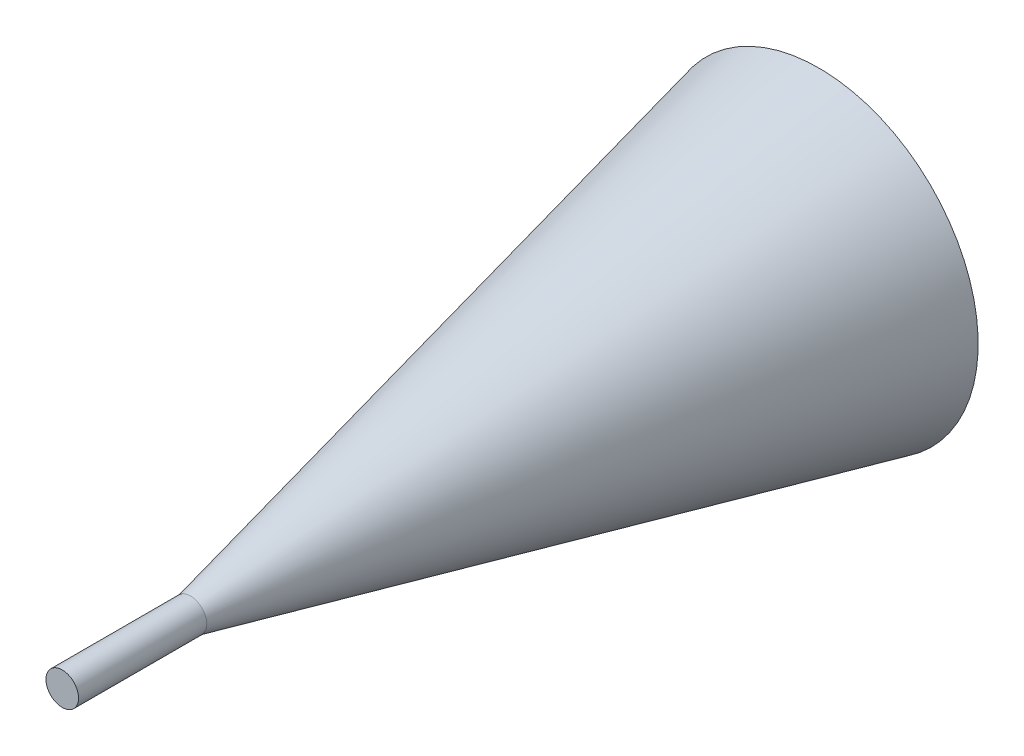
from build123d import *

# Parameters (mm, degrees)
SKETCH1_W           = 71.12
SKETCH1_H           = 71.12
BOSS_EXTRUDE1_DEPTH = 4.7625
SKETCH2_R           = 3.4925
CUT_EXTRUDE1_DEPTH  = 51.514439582
SKETCH3_R           = 12.425
BOSS_EXTRUDE2_DEPTH = 49
SKETCH5_R           = 1.27
BOSS_EXTRUDE3_DEPTH = 10
FILLET1_R           = 2.5
SKETCH6_W           = 86.163151286
SKETCH6_H           = 93.634187614
CUT_EXTRUDE2_DEPTH  = 4.7625
SKETCH7_R           = 2.667
CUT_EXTRUDE3_DEPTH  = 10


with BuildPart() as part:
    # Sketch1 → Boss-Extrude1 (new body)
    with BuildSketch(Plane.XY):
        Rectangle(SKETCH1_W, SKETCH1_H)
    extrude(amount=BOSS_EXTRUDE1_DEPTH)

    # Sketch2 → Cut-Extrude1 (cut, through all)
    with BuildSketch(Plane.XY.offset(4.7625)):
        with Locations((-30.48, 30.48)):
            Circle(SKETCH2_R)
        with Locations((30.48, 30.48)):
            Circle(SKETCH2_R)
    cut_extrude1 = extrude(amount=-CUT_EXTRUDE1_DEPTH, mode=Mode.SUBTRACT)

    # Mirror1: Cut-Extrude1 across plane
    add(cut_extrude1.mirror(Plane.ZX), mode=Mode.SUBTRACT)

    # Sketch3 → Boss-Extrude2 (add)
    with BuildSketch(Plane.XY.offset(4.7625)):
        Circle(SKETCH3_R)
    extrude(amount=BOSS_EXTRUDE2_DEPTH)

    # Sketch4 → Cut-Revolve1 (revolve, cut)
    with BuildSketch(Plane(origin=(0, 0, 0), x_dir=(0, 0, -1), z_dir=(1, 0, 0)), mode=Mode.PRIVATE) as cut_revolve1_sk:
        Polygon((-4.7625, 12.425), (-53.7625, 1.245), (-53.7625, 12.425), align=None)
    revolve(cut_revolve1_sk.sketch.rotate(Axis((0, 0, 53.7625), (0, 0, -1)), 270), axis=Axis((0, 0, 53.7625), (0, 0, -1)), mode=Mode.SUBTRACT)

    # Sketch5 → Boss-Extrude3 (add)
    with BuildSketch(Plane.XY.offset(53.7625)):
        Circle(SKETCH5_R)
    extrude(amount=BOSS_EXTRUDE3_DEPTH)

    # Fillet1
    fillet1_edges = [part.edges().sort_by_distance(p)[0] for p in [
        (-35.56, 35.56, 2.38125),
        (35.56, 35.56, 2.38125),
        (35.56, -35.56, 2.38125),
        (-35.56, -35.56, 2.38125),
    ]]
    fillet(fillet1_edges, radius=FILLET1_R)

    # Sketch6 → Cut-Extrude2 (cut)
    with BuildSketch(Plane(origin=(0, 0, 0), x_dir=(-1, 0, 0), z_dir=(0, 0, -1))):
        Rectangle(SKETCH6_W, SKETCH6_H)
    extrude(amount=-CUT_EXTRUDE2_DEPTH, mode=Mode.SUBTRACT)

    # Sketch7 → Cut-Extrude3 (cut)
    with BuildSketch(Plane(origin=(0, 0, 4.7625), x_dir=(-1, 0, 0), z_dir=(0, 0, -1))):
        Circle(SKETCH7_R)
    extrude(amount=-CUT_EXTRUDE3_DEPTH, mode=Mode.SUBTRACT)


solid = part.part
